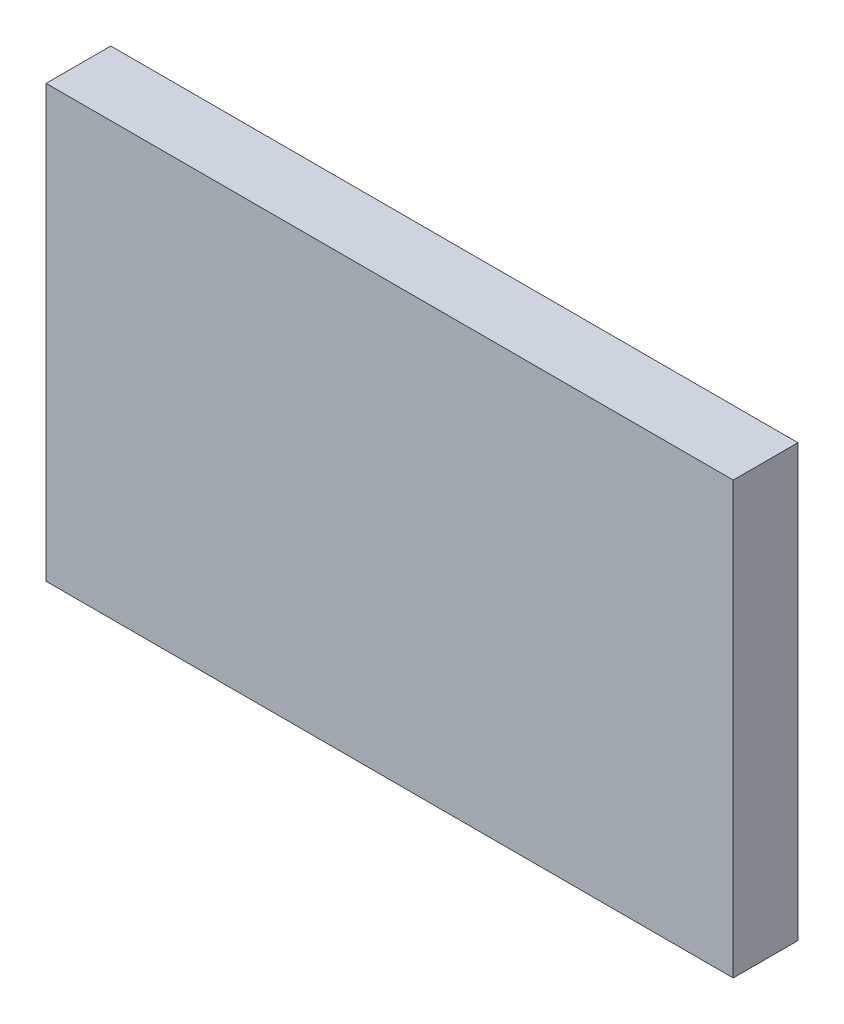
from build123d import *

# Parameters (mm, degrees)
ESQUISSE1_W             = 10.623856
ESQUISSE1_H             = 6.6675
COMPONENT_OUTLINE_DEPTH = 1


with BuildPart() as part:
    # Esquisse1 → Component_Outline (new body)
    with BuildSketch(Plane.XY):
        with Locations((-0.050372, 0.03175)):
            Rectangle(ESQUISSE1_W, ESQUISSE1_H)
    extrude(amount=COMPONENT_OUTLINE_DEPTH)


solid = part.part
